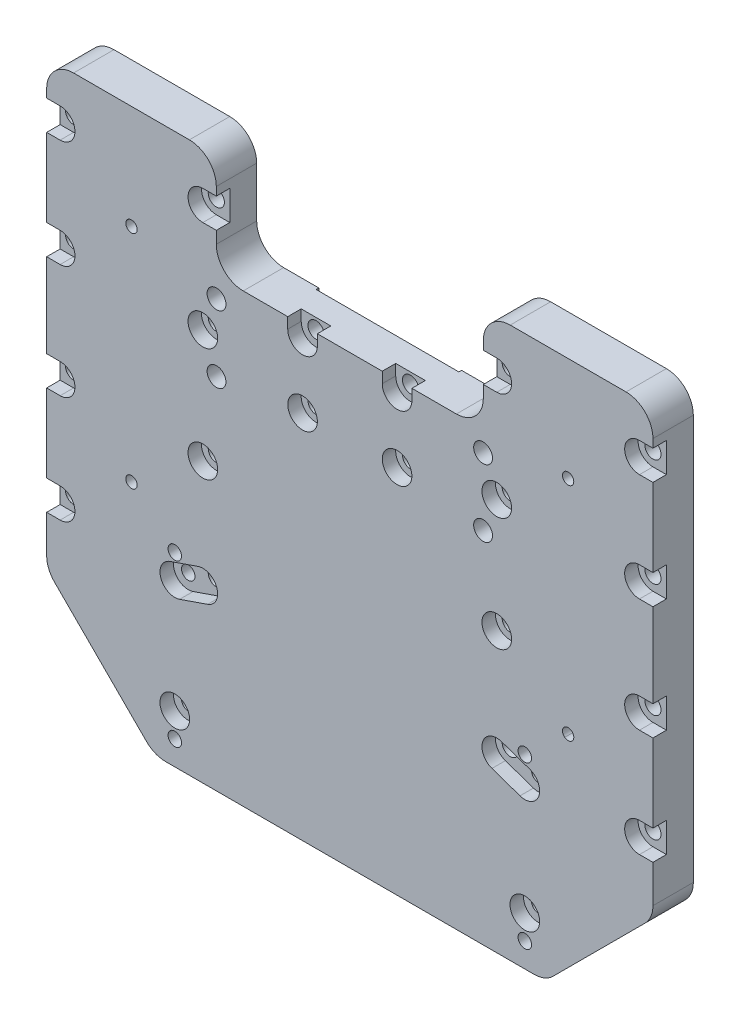
from build123d import *

# Parameters (mm, degrees)
SKETCH1_W                       = 225.16353247
SKETCH1_H                       = 204.4
BOSS_EXTRUDE1_DEPTH             = 15
HOLE1_D                         = 6
HOLE1_CBORE_D                   = 11
HOLE1_CBORE_DEPTH               = 5
M5X0_8_TAPPED_HOLE1_D           = 4.2
M5X0_8_TAPPED_HOLE1_ON_FACE_2_D = 4.2
CUT_EXTRUDE1_DEPTH              = 5
M6X1_0_TAPPED_HOLE1_D           = 5
HOLE2_D                         = 5
HOLE2_CBORE_D                   = 11
HOLE2_CBORE_DEPTH               = 5
CUT_EXTRUDE2_DEPTH              = 5
CHAMFER1_SIZE                   = 40
SKETCH16_W                      = 53
SKETCH16_H                      = 35.620178703
SKETCH16_H_2                    = 37.110089351
CUT_EXTRUDE3_DEPTH              = 1
SKETCH16_3_W                    = 53
SKETCH16_3_H                    = 130.179821297
CUT_EXTRUDE4_DEPTH              = 5
CUT_EXTRUDE5_DEPTH              = 256.382465743
CUT_EXTRUDE6_DEPTH              = 5
FILLET1_R                       = 10
OLDSPINDLEMOUNTM8HOLES_D        = 7


with BuildPart() as part:
    # Sketch1 → Boss-Extrude1 (new body)
    with BuildSketch(Plane.XY):
        with Locations((81.081766235, -63.6)):
            Rectangle(SKETCH1_W, SKETCH1_H)
    extrude(amount=BOSS_EXTRUDE1_DEPTH)

    # Hole1 (through all)
    with Locations(Plane(origin=(-26.5, 20, 15), x_dir=(1, 0, 0), z_dir=(0, 0, 1))):
        with Locations((0, 0), (53, -40), (53, 0), (0, -40), (53, -82.2), (53, -122.2), (0, -82.2), (0, -122.2), (162.16353247, 0), (162.16353247, -40), (215.16353247, 0), (215.16353247, -82.2), (215.16353247, -40), (162.16353247, -122.2), (162.16353247, -82.2), (215.16353247, -122.2), (90.031766235, -24.020178703), (90.031766235, -48.220178703), (125.131766235, -48.220178703), (125.131766235, -24.020178703)):
            CounterBoreHole(HOLE1_D / 2, HOLE1_CBORE_D / 2, HOLE1_CBORE_DEPTH)

    # M5x0.8 Tapped Hole1 (through all)
    with Locations(Plane(origin=(162.164010883, -82.200361066, 15), x_dir=(1, 0, 0), z_dir=(0, 0, 1))):
        with Locations((0, 0), (-162.164010883, 0.000361066), (-0.000478413, 82.200361066), (-0.000478413, 0.000361066), (-162.164010883, 82.200361066)):
            Hole(M5X0_8_TAPPED_HOLE1_D / 2)

    # M5x0.8 Tapped Hole1 on face 2 (through all)
    with Locations(Plane(origin=(0, 0, 0), x_dir=(-1, 0, 0), z_dir=(0, 0, -1))):
        with Locations((0, 0)):
            Hole(M5X0_8_TAPPED_HOLE1_ON_FACE_2_D / 2)

    # Sketch9 → Cut-Extrude1 (cut)
    with BuildSketch(Plane.XY.offset(15)):
        with BuildLine():
            Line((-31.5, 14.5), (-26.5, 14.5))
            ThreePointArc((-26.5, 14.5), (-29.470514841, 15.371172764), (-31.5, 17.708712153))
            Line((-31.5, 17.708712153), (-31.5, 14.5))
        make_face()
        with BuildLine():
            ThreePointArc((-31.5, 22.291287847), (-29.470514841, 24.628827236), (-26.5, 25.5))
            Line((-26.5, 25.5), (-31.5, 25.5))
            Line((-31.5, 25.5), (-31.5, 22.291287847))
        make_face()
        with BuildLine():
            Line((-26.5, -14.5), (-31.5, -14.5))
            Line((-31.5, -14.5), (-31.5, -17.708712153))
            ThreePointArc((-31.5, -17.708712153), (-29.470514841, -15.371172764), (-26.5, -14.5))
        make_face()
        with BuildLine():
            Line((-31.5, -25.5), (-26.5, -25.5))
            ThreePointArc((-26.5, -25.5), (-29.470514841, -24.628827236), (-31.5, -22.291287847))
            Line((-31.5, -22.291287847), (-31.5, -25.5))
        make_face()
        with BuildLine():
            Line((-26.5, -56.7), (-31.5, -56.7))
            Line((-31.5, -56.7), (-31.5, -59.908712153))
            ThreePointArc((-31.5, -59.908712153), (-29.470514841, -57.571172764), (-26.5, -56.7))
        make_face()
        with BuildLine():
            Line((-31.5, -67.7), (-26.5, -67.7))
            ThreePointArc((-26.5, -67.7), (-29.470514841, -66.828827236), (-31.5, -64.491287847))
            Line((-31.5, -64.491287847), (-31.5, -67.7))
        make_face()
        with BuildLine():
            Line((-26.5, -96.7), (-31.5, -96.7))
            Line((-31.5, -96.7), (-31.5, -99.908712153))
            ThreePointArc((-31.5, -99.908712153), (-29.470514841, -97.571172764), (-26.5, -96.7))
        make_face()
        with BuildLine():
            Line((-31.5, -107.7), (-26.5, -107.7))
            ThreePointArc((-26.5, -107.7), (-29.470514841, -106.828827236), (-31.5, -104.491287847))
            Line((-31.5, -104.491287847), (-31.5, -107.7))
        make_face()
        with BuildLine():
            ThreePointArc((193.66353247, -104.491287847), (191.634047311, -106.828827236), (188.66353247, -107.7))
            Line((188.66353247, -107.7), (193.66353247, -107.7))
            Line((193.66353247, -107.7), (193.66353247, -104.491287847))
        make_face()
        with BuildLine():
            Line((193.66353247, -99.908712153), (193.66353247, -96.7))
            Line((193.66353247, -96.7), (188.66353247, -96.7))
            ThreePointArc((188.66353247, -96.7), (191.634047311, -97.571172764), (193.66353247, -99.908712153))
        make_face()
        with BuildLine():
            ThreePointArc((193.66353247, -64.491287847), (191.634047311, -66.828827236), (188.66353247, -67.7))
            Line((188.66353247, -67.7), (193.66353247, -67.7))
            Line((193.66353247, -67.7), (193.66353247, -64.491287847))
        make_face()
        with BuildLine():
            Line((193.66353247, -59.908712153), (193.66353247, -56.7))
            Line((193.66353247, -56.7), (188.66353247, -56.7))
            ThreePointArc((188.66353247, -56.7), (191.634047311, -57.571172764), (193.66353247, -59.908712153))
        make_face()
        with BuildLine():
            ThreePointArc((193.66353247, -22.291287848), (191.634047311, -24.628827236), (188.66353247, -25.5))
            Line((188.66353247, -25.5), (193.66353247, -25.5))
            Line((193.66353247, -25.5), (193.66353247, -22.291287848))
        make_face()
        with BuildLine():
            Line((193.66353247, -17.708712153), (193.66353247, -14.5))
            Line((193.66353247, -14.5), (188.66353247, -14.5))
            ThreePointArc((188.66353247, -14.5), (191.634047311, -15.371172764), (193.66353247, -17.708712153))
        make_face()
        with BuildLine():
            ThreePointArc((193.66353247, 17.708712152), (191.634047311, 15.371172764), (188.66353247, 14.5))
            Line((188.66353247, 14.5), (193.66353247, 14.5))
            Line((193.66353247, 14.5), (193.66353247, 17.708712152))
        make_face()
        with BuildLine():
            Line((193.66353247, 25.5), (188.66353247, 25.5))
            ThreePointArc((188.66353247, 25.5), (191.634047311, 24.628827236), (193.66353247, 22.291287847))
            Line((193.66353247, 22.291287847), (193.66353247, 25.5))
        make_face()
    extrude(amount=-CUT_EXTRUDE1_DEPTH, mode=Mode.SUBTRACT)

    # M6x1.0 Tapped Hole1 (through all)
    with Locations(Plane(origin=(16.081766235, -96.8, 15), x_dir=(1, 0, 0), z_dir=(0, 0, 1))):
        with Locations((0, 0), (130, 0), (130, -60), (0, -60)):
            Hole(M6X1_0_TAPPED_HOLE1_D / 2)

    # Hole2 (through all)
    with Locations(Plane(origin=(16.081766235, -105.8, 15), x_dir=(1, 0, 0), z_dir=(0, 0, 1))):
        with Locations((0, 0), (0, -42), (130, 0), (130, -42)):
            CounterBoreHole(HOLE2_D / 2, HOLE2_CBORE_D / 2, HOLE2_CBORE_DEPTH)

    # Sketch15 → Cut-Extrude2 (cut)
    with BuildSketch(Plane.XY.offset(15)):
        with BuildLine():
            Line((24.703704526, -97.001603846), (14.285470762, -100.601603846))
            ThreePointArc((14.285470762, -100.601603846), (19.273190282, -101.320623643), (21.581766235, -105.8))
            ThreePointArc((21.581766235, -105.8), (20.561142593, -108.991424047), (17.878061709, -110.998396154))
            Line((17.878061709, -110.998396154), (28.296295473, -107.398396154))
            ThreePointArc((28.296295473, -107.398396154), (21.301603846, -103.996295474), (24.703704526, -97.001603846))
        make_face()
        with BuildLine():
            Line((133.867236997, -107.398396154), (144.285470762, -110.998396154))
            ThreePointArc((144.285470762, -110.998396154), (140.883370081, -104.003704527), (147.878061709, -100.601603846))
            Line((147.878061709, -100.601603846), (137.459827944, -97.001603846))
            ThreePointArc((137.459827944, -97.001603846), (140.142908828, -99.008575953), (141.16353247, -102.2))
            ThreePointArc((141.16353247, -102.2), (138.854956517, -106.679376358), (133.867236997, -107.398396154))
        make_face()
    extrude(amount=-CUT_EXTRUDE2_DEPTH, mode=Mode.SUBTRACT)

    # Chamfer1
    chamfer1_edges = [part.edges().sort_by_distance(p)[0] for p in [
        (193.66353247, -165.8, 7.5),
        (-31.5, -165.8, 7.5),
    ]]
    chamfer(chamfer1_edges, length=CHAMFER1_SIZE)

    # Sketch16 → Cut-Extrude3 (cut)
    with BuildSketch(Plane(origin=(0, 0, 0), x_dir=(-1, 0, 0), z_dir=(0, 0, -1))):
        with Locations((-81.081766235, -17.810089352)):
            Rectangle(SKETCH16_W, SKETCH16_H)
        with Locations((-81.081766235, 20.044955325)):
            Rectangle(SKETCH16_W, SKETCH16_H_2)
    extrude(amount=-CUT_EXTRUDE3_DEPTH, mode=Mode.SUBTRACT)

    # Sketch16<3> → Cut-Extrude4 (cut)
    with BuildSketch(Plane(origin=(0, 0, 0), x_dir=(-1, 0, 0), z_dir=(0, 0, -1))):
        with Locations((-81.081766235, -100.710089352)):
            Rectangle(SKETCH16_3_W, SKETCH16_3_H)
    extrude(amount=-CUT_EXTRUDE4_DEPTH, mode=Mode.SUBTRACT)

    # Sketch16<4> → Cut-Extrude5 (cut, through all)
    with BuildSketch(Plane(origin=(0, 0, 0), x_dir=(-1, 0, 0), z_dir=(0, 0, -1))):
        Polygon((-54.581766235, 1.489910649), (-107.581766235, 1.489910649), (-107.581766235, 38.6), (-130.66353247, 38.6), (-130.66353247, 0), (-31.5, 0), (-31.5, 38.6), (-54.581766235, 38.6), align=None)
    extrude(amount=-CUT_EXTRUDE5_DEPTH, mode=Mode.SUBTRACT)


with BuildPart() as cut_extrude5_kept_piece:
    # of the separate pieces the step leaves, the one the design keeps (cut_extrude5_pieces_kept)
    add(part.part.solids().sort_by_distance((193.66353247, -125.8, 15))[0])

    # Sketch17 → Cut-Extrude6 (cut)
    with BuildSketch(Plane.XY.offset(15)):
        with BuildLine():
            Line((26.5, 25.5), (37.535291554, 25.5))
            ThreePointArc((37.535291554, 25.5), (43.035291554, 20), (37.535291554, 14.5))
            Line((37.535291554, 14.5), (26.5, 14.5))
            ThreePointArc((26.5, 14.5), (21, 20), (26.5, 25.5))
        make_face()
        with BuildLine():
            Line((58.031766235, -4.020178703), (58.031766235, 6.878958383))
            ThreePointArc((58.031766235, 6.878958383), (63.531766235, 12.378958383), (69.031766235, 6.878958383))
            Line((69.031766235, 6.878958383), (69.031766235, -4.020178703))
            ThreePointArc((69.031766235, -4.020178703), (63.531766235, -9.520178703), (58.031766235, -4.020178703))
        make_face()
        with BuildLine():
            Line((93.131766235, -4.020178703), (93.131766235, 8.238121163))
            ThreePointArc((93.131766235, 8.238121163), (98.631766235, 13.738121163), (104.131766235, 8.238121163))
            Line((104.131766235, 8.238121163), (104.131766235, -4.020178703))
            ThreePointArc((104.131766235, -4.020178703), (98.631766235, -9.520178703), (93.131766235, -4.020178703))
        make_face()
        with BuildLine():
            Line((135.66353247, 14.5), (124.67272757, 14.5))
            ThreePointArc((124.67272757, 14.5), (119.17272757, 20), (124.67272757, 25.5))
            Line((124.67272757, 25.5), (135.66353247, 25.5))
            ThreePointArc((135.66353247, 25.5), (141.16353247, 20), (135.66353247, 14.5))
        make_face()
    extrude(amount=-CUT_EXTRUDE6_DEPTH, mode=Mode.SUBTRACT)

    # Fillet1
    fillet1_edges = [cut_extrude5_kept_piece.edges().sort_by_distance(p)[0] for p in [
        (193.66353247, -125.8, 7.5),
        (8.5, -165.8, 7.5),
        (153.66353247, -165.8, 7.5),
        (-31.5, -125.8, 7.5),
        (31.5, 0, 7.5),
        (130.66353247, 38.6, 7.5),
        (31.5, 38.6, 7.5),
        (130.66353247, 0, 7.5),
        (-31.5, 38.6, 7.5),
        (193.66353247, 38.6, 7.5),
    ]]
    fillet(fillet1_edges, radius=FILLET1_R)

    # oldSpindleMountM8holes (through all)
    with Locations(Plane(origin=(31.581766235, -7.5, 15), x_dir=(1, 0, 0), z_dir=(0, 0, 1))):
        with Locations((0, 0), (0, -25), (99, 0), (99, -25)):
            Hole(OLDSPINDLEMOUNTM8HOLES_D / 2)


solid = cut_extrude5_kept_piece.part
